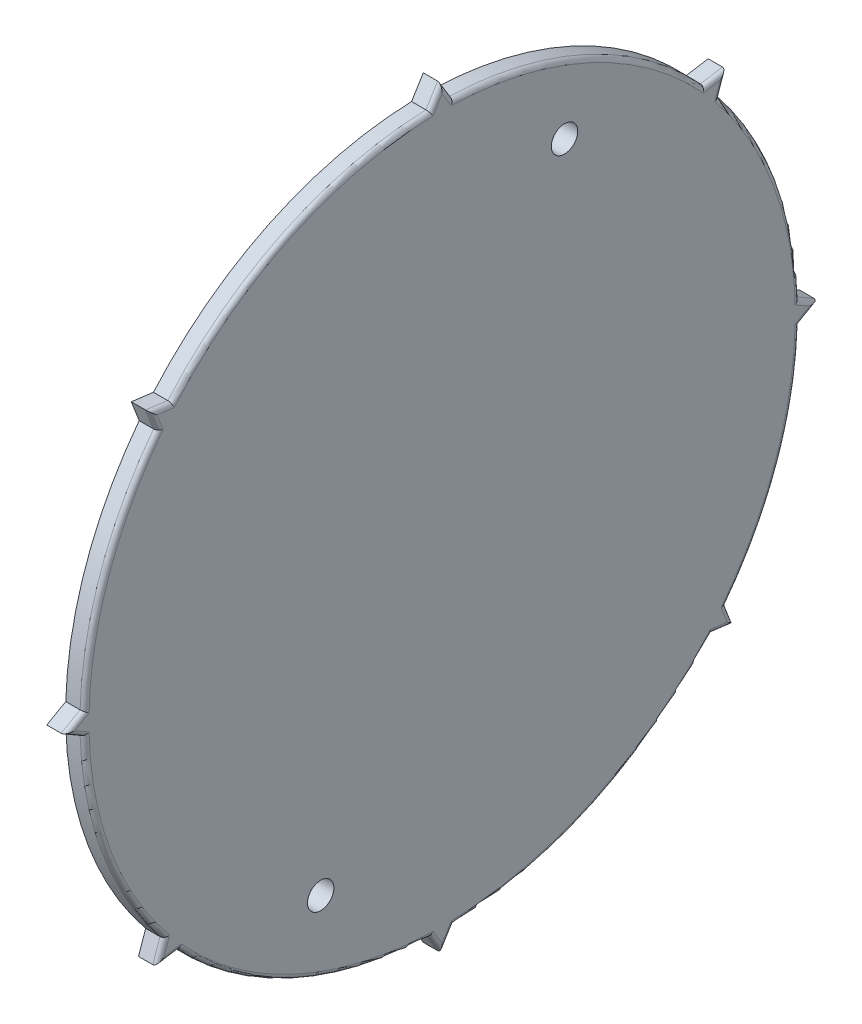
from build123d import *

# Parameters (mm, degrees)
RESSALTO_EXTRUS_O1_DEPTH = 0.5
FILETE2_R                = 0.12
ESBO_O3_R                = 0.35
CORTE_EXTRUS_O1_DEPTH    = 0.5


with BuildPart() as part:
    # Esboço1 → Ressalto-extrusão1 (new body)
    with BuildSketch(Plane(origin=(0, 0, 0), x_dir=(0, 0, -1), z_dir=(1, 0, 0))):
        with BuildLine():
            Line((7.755818376, -6.312470303), (7.546549647, -5.770579557))
            ThreePointArc((7.546549647, -5.770579557), (8.951430844, -3.181491135), (9.495678331, -0.286518819))
            Line((9.495678331, -0.286518819), (10, 0))
            Line((10, 0), (9.495513044, 0.291945241))
            ThreePointArc((9.495513044, 0.291945241), (8.903037488, 3.314501996), (7.374694694, 5.988645771))
            Line((7.374694694, 5.988645771), (7.564299357, 6.540747299))
            Line((7.564299357, 6.540747299), (6.979531804, 6.444853435))
            ThreePointArc((6.979531804, 6.444853435), (3.95093379, 8.639451498), (0.30994469, 9.494942564))
            Line((0.30994469, 9.494942564), (0, 10))
            Line((0, 10), (-0.312056411, 9.494873395))
            ThreePointArc((-0.312056411, 9.494873395), (-4.079212885, 8.579628328), (-7.167066673, 6.235635918))
            Line((-7.167066673, 6.235635918), (-7.755818376, 6.312470303))
            Line((-7.755818376, 6.312470303), (-7.545539803, 5.771899955))
            ThreePointArc((-7.545539803, 5.771899955), (-8.951152463, 3.182274278), (-9.495678331, 0.286518819))
            Line((-9.495678331, 0.286518819), (-10, 0))
            Line((-10, 0), (-9.495513044, -0.291945241))
            ThreePointArc((-9.495513044, -0.291945241), (-8.902746815, -3.315282665), (-7.373644327, -5.98993901))
            Line((-7.373644327, -5.98993901), (-7.564299357, -6.540747299))
            Line((-7.564299357, -6.540747299), (-6.976885209, -6.447718417))
            ThreePointArc((-6.976885209, -6.447718417), (-3.949160195, -8.640262366), (-0.30994469, -9.494942564))
            Line((-0.30994469, -9.494942564), (0, -10))
            Line((0, -10), (0.312056411, -9.494873395))
            ThreePointArc((0.312056411, -9.494873395), (4.077471711, -8.580455958), (7.16453525, -6.238544273))
            Line((7.16453525, -6.238544273), (7.755818376, -6.312470303))
        make_face()
    extrude(amount=RESSALTO_EXTRUS_O1_DEPTH)

    # Filete2
    filete2_edges = [part.edges().sort_by_distance(p)[0] for p in [
        (0.5, -0.14325941, -9.747839166),
        (0.5, 0.145972621, -9.747756522),
        (0.5, 3.314501996, -8.903037488),
        (0.5, 6.264696535, -7.469497026),
        (0.5, 6.492800367, -7.271915581),
        (0.5, 8.639451498, -3.95093379),
        (0.5, 9.747471282, -0.154972345),
        (0.5, 9.747436698, 0.156028205),
        (0.5, 8.579628328, 4.079212885),
        (0.5, 6.274053111, 7.461442524),
        (0.5, -6.04152493, -7.651184011),
        (0.5, 6.042185129, 7.650679089),
        (0.5, 3.182274278, 8.951152463),
        (0.5, 0.14325941, 9.747839166),
        (0.5, -0.145972621, 9.747756522),
        (0.5, -3.315282665, 8.902746815),
        (0.5, -6.265343155, 7.468971842),
        (0.5, -6.494232858, 7.270592283),
        (0.5, -8.640262366, 3.949160195),
        (0.5, -9.747471282, 0.154972345),
        (0.5, -3.181491135, -8.951430844),
        (0.5, -9.747436698, -0.156028205),
        (0.5, -8.580455958, -4.077471711),
        (0.5, -6.275507288, -7.460176813),
    ]]
    fillet(filete2_edges, radius=FILETE2_R)

    # Esboço3 → Corte-extrusão1 (cut)
    with BuildSketch(Plane(origin=(0.5, 0, 0), x_dir=(0, 0, -1), z_dir=(1, 0, 0))):
        with Locations((3.249745018, 7.105782814)):
            Circle(ESBO_O3_R)
        with Locations((-3.225311319, -7.056999805)):
            Circle(ESBO_O3_R)
    extrude(amount=-CORTE_EXTRUS_O1_DEPTH, mode=Mode.SUBTRACT)


solid = part.part
